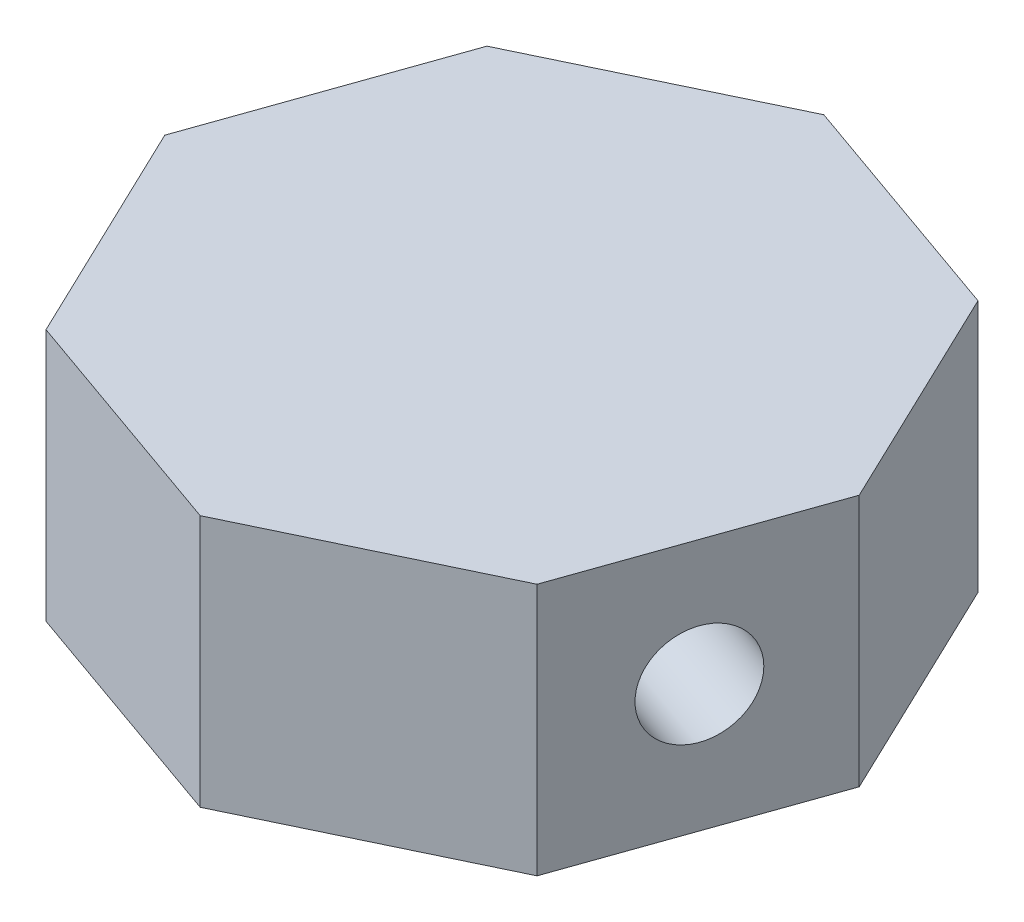
from build123d import *

# Parameters (mm, degrees)
BOSS_EXTRUDE1_DEPTH = 12.7
CUT_EXTRUDE1_DEPTH  = 12.7
CUT_EXTRUDE2_DEPTH  = 2.54


with BuildPart() as part:
    # Sketch1 → Boss-Extrude1 (new body)
    with BuildSketch(Plane(origin=(0, 0, 0), x_dir=(1, 0, 0), z_dir=(0, 1, 0))):
        Polygon((-10.842199515, -5.384904617), (0.613239188, 0.098062109), (4.836414625, 12.07532345), (-0.6465521, 23.530762153), (-12.623813441, 27.75393759), (-24.079252145, 22.270970865), (-28.302427581, 10.293709523), (-22.819460856, -1.16172918), align=None)
    extrude(amount=BOSS_EXTRUDE1_DEPTH)

    # Sketch2 → Cut-Extrude1 (cut)
    with BuildSketch(Plane(origin=(0.514674893, 0, 0.18147407), x_dir=(0.33253349893190465, 0, -0.9430914441813716), z_dir=(0.9430914441813716, 0, 0.33253349893190465))):
        with BuildLine():
            ThreePointArc((9.236420315, 6.400016207), (9.043074328, 7.372032125), (8.49247154, 8.196067431))
            Line((8.49247154, 8.196067431), (6.646404109, 6.35))
            Line((6.646404109, 6.35), (8.441758775, 4.554645333))
            ThreePointArc((8.441758775, 4.554645333), (9.029311192, 5.395416707), (9.236420315, 6.400016207))
        make_face()
        with BuildLine():
            Line((6.646404109, 6.35), (8.49247154, 8.196067431))
            ThreePointArc((8.49247154, 8.196067431), (6.661050087, 8.939769925), (4.851049442, 8.145354667))
            Line((4.851049442, 8.145354667), (6.646404109, 6.35))
        make_face()
        with BuildLine():
            Line((8.441758775, 4.554645333), (6.646404109, 6.35))
            Line((6.646404109, 6.35), (4.900369091, 4.603964983))
            ThreePointArc((4.900369091, 4.603964983), (6.661050087, 3.860262489), (8.441758775, 4.554645333))
        make_face()
        with BuildLine():
            Line((4.900369091, 4.603964983), (6.646404109, 6.35))
            Line((6.646404109, 6.35), (4.851049442, 8.145354667))
            ThreePointArc((4.851049442, 8.145354667), (4.156666598, 6.364645978), (4.900369091, 4.603964983))
        make_face()
    extrude(amount=-CUT_EXTRUDE1_DEPTH, mode=Mode.SUBTRACT)

    # Sketch3 → Cut-Extrude2 (cut)
    with BuildSketch(Plane.XZ):
        with BuildLine():
            ThreePointArc((-14.953750816, -11.01136249), (-13.141781341, -14.030145133), (-9.65800947, -13.520620278))
            Line((-9.65800947, -13.520620278), (-11.762472687, -11.182932321))
            Line((-11.762472687, -11.182932321), (-14.953750816, -11.01136249))
        make_face()
        with BuildLine():
            Line((-11.762472687, -11.182932321), (-9.65800947, -13.520620278))
            ThreePointArc((-9.65800947, -13.520620278), (-8.922077868, -12.53930026), (-8.613045297, -11.352252168))
            Line((-8.613045297, -11.352252168), (-11.762472687, -11.182932321))
        make_face()
        with BuildLine():
            Line((-14.953750816, -11.01136249), (-11.762472687, -11.182932321))
            Line((-11.762472687, -11.182932321), (-13.906542304, -8.80124863))
            ThreePointArc((-13.906542304, -8.80124863), (-14.651486566, -9.801429), (-14.953750816, -11.01136249))
        make_face()
        with BuildLine():
            Line((-13.906542304, -8.80124863), (-11.762472687, -11.182932321))
            Line((-11.762472687, -11.182932321), (-8.613045297, -11.352252168))
            ThreePointArc((-8.613045297, -11.352252168), (-8.608718567, -11.256636797), (-8.607275887, -11.160934454))
            ThreePointArc((-8.607275887, -11.160934454), (-10.490749827, -8.260488723), (-13.906542304, -8.80124863))
        make_face()
    extrude(amount=-CUT_EXTRUDE2_DEPTH, mode=Mode.SUBTRACT)


solid = part.part
